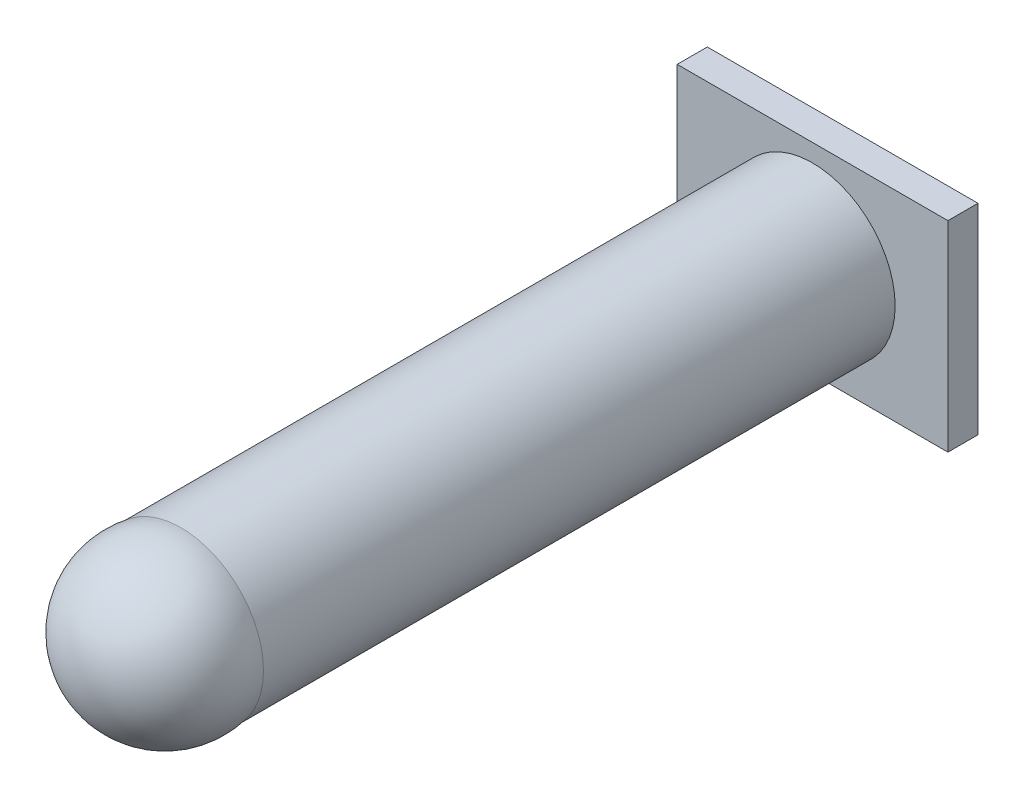
from build123d import *

# Parameters (mm, degrees)
ESQUISSE1_W        = 27
ESQUISSE1_H        = 20
BOSS_EXTRU_1_DEPTH = 3
ESQUISSE2_R        = 8.23653306
BOSS_EXTRU_2_DEPTH = 63
D_ME1_FACE_RADIUS  = 8.23653306
D_ME1_HEIGHT       = 10


with BuildPart() as part:
    # Esquisse1 → Boss.-Extru.1 (new body)
    with BuildSketch(Plane.XY):
        with Locations((-32.019829949, 16.119881557)):
            Rectangle(ESQUISSE1_W, ESQUISSE1_H)
    extrude(amount=BOSS_EXTRU_1_DEPTH)

    # Esquisse2 → Boss.-Extru.2 (add)
    with BuildSketch(Plane.XY.offset(3)):
        with Locations((-32.019829949, 16.119881557)):
            Circle(ESQUISSE2_R)
    extrude(amount=BOSS_EXTRU_2_DEPTH)

    # Dôme1: a dome of height H over a round flat face of radius A is a cap of a sphere of radius (A * A + H * H) / (2 * H)
    d_me1_r = (D_ME1_FACE_RADIUS * D_ME1_FACE_RADIUS + D_ME1_HEIGHT * D_ME1_HEIGHT) / (2 * D_ME1_HEIGHT)
    d_me1_base = Plane((-32.019829949, 16.119881557, 66), z_dir=(0, 0, 1))
    with Locations(d_me1_base.offset(D_ME1_HEIGHT - d_me1_r)):
        d_me1_ball = Sphere(d_me1_r, mode=Mode.PRIVATE)
    add(split(d_me1_ball, bisect_by=d_me1_base, keep=Keep.TOP, mode=Mode.PRIVATE))


solid = part.part
